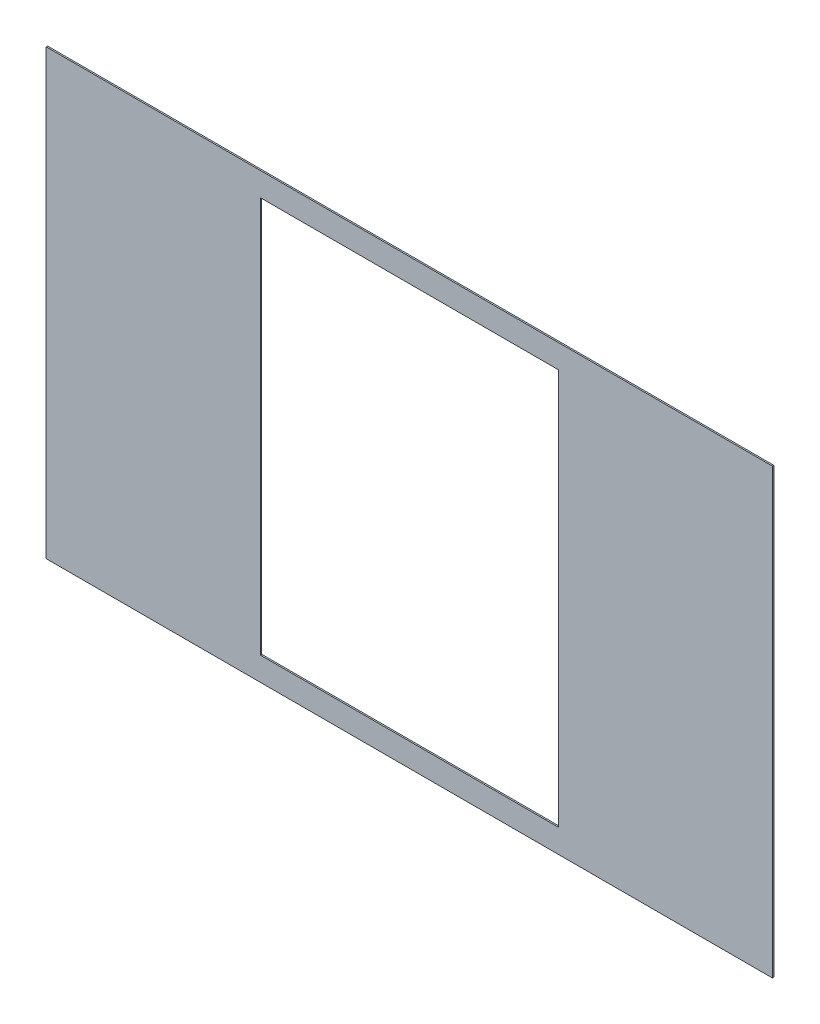
from build123d import *

# Parameters (mm, degrees)
SKETCH1_W               = 770
SKETCH1_H               = 470
BOSS_EXTRUDE1_DEPTH     = 1.5
CUT_EXTRUDE4_DEPTH      = 17
CUT_EXTRUDE4_DEPTH_BACK = 10
SKETCH3_W               = 316
SKETCH3_H               = 420


with BuildPart() as part:
    # Sketch1 → Boss-Extrude1 (new body)
    with BuildSketch(Plane.XY):
        Rectangle(SKETCH1_W, SKETCH1_H)
    extrude(amount=BOSS_EXTRUDE1_DEPTH)

    # Sketch3 → Cut-Extrude4 (cut, two sides: drawn at the far end of the back side and taken through both)
    with BuildSketch(Plane.XY.offset(1.5).offset(-CUT_EXTRUDE4_DEPTH_BACK)):
        Rectangle(SKETCH3_W, SKETCH3_H)
    extrude(amount=CUT_EXTRUDE4_DEPTH + CUT_EXTRUDE4_DEPTH_BACK, mode=Mode.SUBTRACT)


solid = part.part
